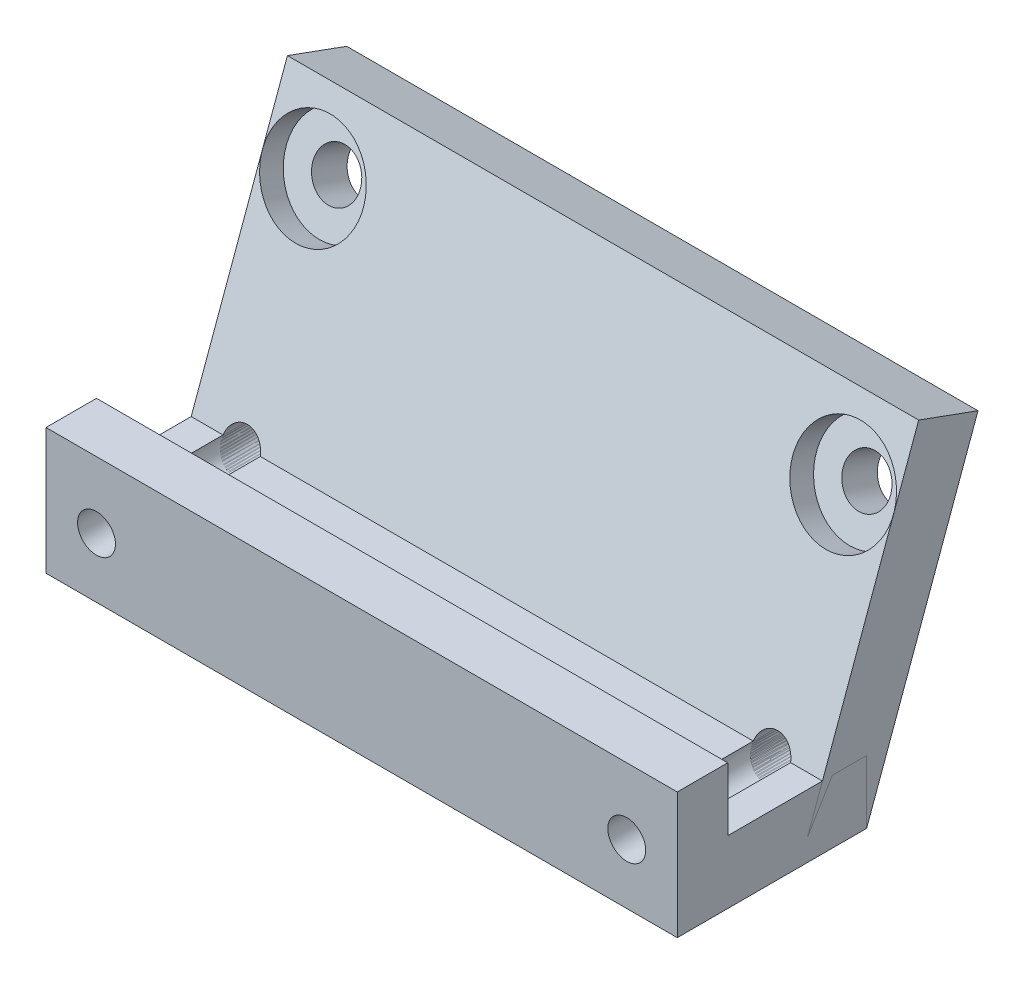
from build123d import *

# Parameters (mm, degrees)
ESQUISSE15_W             = 50
ESQUISSE15_H             = 15
BOSS_EXTRU_6_DEPTH       = 5
ESQUISSE16_W             = 50
ESQUISSE16_H             = 4
BOSS_EXTRU_7_DEPTH       = 5
ESQUISSE20_W             = 50
ESQUISSE20_H             = 25.793082928
BOSS_EXTRU_8_DEPTH       = 5
ESQUISSE22_R             = 1.88406027
ENL_V_MAT_EXTRU_7_DEPTH  = 41.356324256
ESQUISSE23_R             = 1.5
ENL_V_MAT_EXTRU_8_DEPTH  = 44.194415838
ESQUISSE24_R             = 3.998275397
ENL_V_MAT_EXTRU_9_DEPTH  = 2
ESQUISSE26_W             = 40
ESQUISSE26_H             = 2
ENL_V_MAT_EXTRU_10_DEPTH = 40.556052012
ESQUISSE27_R             = 3.997293698
ENL_V_MAT_EXTRU_11_DEPTH = 6
ESQUISSE28_R             = 1.5
ENL_V_MAT_EXTRU_12_DEPTH = 44.194415838


with BuildPart() as part:
    # Esquisse15 → Boss.-Extru.6 (new body)
    with BuildSketch(Plane(origin=(0, 0, 0), x_dir=(1, 0, 0), z_dir=(0, 1, 0))):
        Rectangle(ESQUISSE15_W, ESQUISSE15_H)
    extrude(amount=BOSS_EXTRU_6_DEPTH)

    # Esquisse16 → Boss.-Extru.7 (add)
    with BuildSketch(Plane(origin=(0, 5, 0), x_dir=(1, 0, 0), z_dir=(0, 1, 0))):
        with Locations((0, -5.5)):
            Rectangle(ESQUISSE16_W, ESQUISSE16_H)
    extrude(amount=BOSS_EXTRU_7_DEPTH)


with BuildPart() as body_2:
    # Esquisse20 → Boss.-Extru.8 (new body)
    with BuildSketch(Plane(origin=(0, -2.410453536, -6.622666662), x_dir=(-1, 0, 0), z_dir=(0, -0.34202014332566943, -0.9396926207859081))):
        with Locations((0, 15.461692539)):
            Rectangle(ESQUISSE20_W, ESQUISSE20_H)
    extrude(amount=-BOSS_EXTRU_8_DEPTH)

    # Esquisse22 → Enlèv. mat.-Extru.7 (cut, through all)
    with BuildSketch(Plane(origin=(0, -2.410453536, -6.622666662), x_dir=(1, 0, 0), z_dir=(0, -0.34202014332566955, -0.9396926207859082))):
        with Locations(Location((21, -22.565151075, 0), (0, 0, 270))):
            Circle(ESQUISSE22_R)
    enl_v_mat_extru_7 = extrude(amount=-ENL_V_MAT_EXTRU_7_DEPTH, mode=Mode.SUBTRACT)

    # Symétrie5: Enlèv. mat.-Extru.7 across plane
    add(enl_v_mat_extru_7.mirror(Plane(origin=(0, 0, 0), x_dir=(0, 0, 1), z_dir=(1, 0, 0))), mode=Mode.SUBTRACT)


with BuildPart() as enl_v_mat_extru_8_tool:
    # Esquisse23 → Enlèv. mat.-Extru.8 (new, through all)
    with BuildSketch(Plane.XY.offset(7.5)):
        with Locations(Location((21, 4.74119733, 0), (0, 0, 270))):
            Circle(ESQUISSE23_R)
    extrude(amount=-ENL_V_MAT_EXTRU_8_DEPTH)


with BuildPart() as part_1:
    add(part.part)

    # Enlèv. mat.-Extru.8: cut by enl_v_mat_extru_8_tool
    add(enl_v_mat_extru_8_tool.part, mode=Mode.SUBTRACT)

    # Esquisse26 → Enlèv. mat.-Extru.10 (cut, through all)
    with BuildSketch(Plane.XZ):
        with Locations((0, 1)):
            Rectangle(ESQUISSE26_W, ESQUISSE26_H)
    extrude(amount=-ENL_V_MAT_EXTRU_10_DEPTH, mode=Mode.SUBTRACT)


with BuildPart() as body_2_1:
    add(body_2.part)

    # Enlèv. mat.-Extru.8: cut by enl_v_mat_extru_8_tool
    add(enl_v_mat_extru_8_tool.part, mode=Mode.SUBTRACT)

    # Esquisse24 → Enlèv. mat.-Extru.9 (cut)
    with BuildSketch(Plane(origin=(0, -0.70035282, -1.924203558), x_dir=(1, 0, 0), z_dir=(0, 0.34202014332566955, 0.9396926207859082))):
        with Locations(Location((21, 22.565151075, 0), (0, 0, 270))):
            Circle(ESQUISSE24_R)
    enl_v_mat_extru_9 = extrude(amount=-ENL_V_MAT_EXTRU_9_DEPTH, mode=Mode.SUBTRACT)

    # Symétrie7: Enlèv. mat.-Extru.9 across plane
    add(enl_v_mat_extru_9.mirror(Plane(origin=(0, 0, 0), x_dir=(0, 0, 1), z_dir=(1, 0, 0))), mode=Mode.SUBTRACT)

    # Esquisse27 → Enlèv. mat.-Extru.11 (cut)
    with BuildSketch(Plane.XY.offset(-7.5)):
        with Locations((21, 4.74119733)):
            Circle(ESQUISSE27_R)
    enl_v_mat_extru_11 = extrude(amount=-ENL_V_MAT_EXTRU_11_DEPTH, mode=Mode.SUBTRACT)

    # Symétrie8: Enlèv. mat.-Extru.11 across plane
    add(enl_v_mat_extru_11.mirror(Plane(origin=(0, 0, 0), x_dir=(0, 0, 1), z_dir=(1, 0, 0))), mode=Mode.SUBTRACT)


with BuildPart() as enl_v_mat_extru_12_tool:
    # Esquisse28 → Enlèv. mat.-Extru.12 (new, through all)
    with BuildSketch(Plane.XY.offset(7.5)):
        with Locations((-21, 4.737942788)):
            Circle(ESQUISSE28_R)
    extrude(amount=-ENL_V_MAT_EXTRU_12_DEPTH)


with BuildPart() as part_2:
    add(part_1.part)

    # Enlèv. mat.-Extru.12: cut by enl_v_mat_extru_12_tool
    add(enl_v_mat_extru_12_tool.part, mode=Mode.SUBTRACT)


with BuildPart() as body_2_2:
    add(body_2_1.part)

    # Enlèv. mat.-Extru.12: cut by enl_v_mat_extru_12_tool
    add(enl_v_mat_extru_12_tool.part, mode=Mode.SUBTRACT)


solid = Compound([part_2.part, body_2_2.part])
